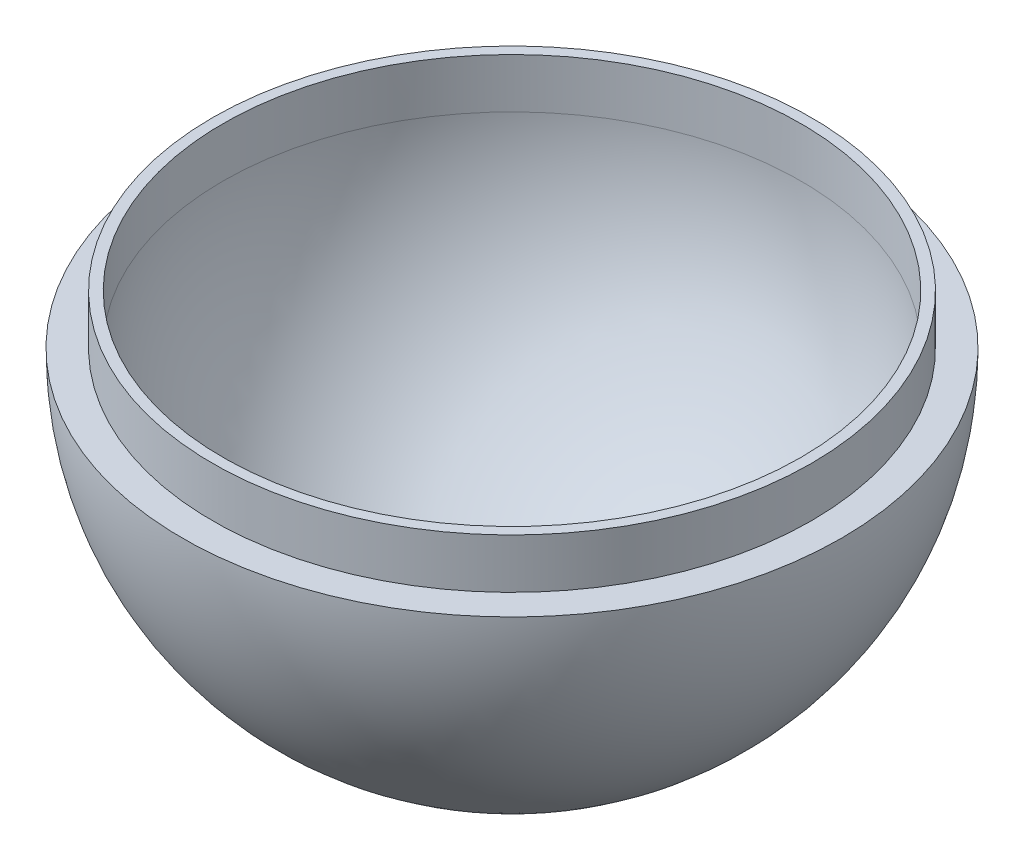
from build123d import *


with BuildPart() as part:
    # Sketch1 → Revolve2 (revolve)
    with BuildSketch(Plane.XY, mode=Mode.PRIVATE) as revolve2_sk:
        with BuildLine():
            Line((0, -25), (0, -28.503418665))
            ThreePointArc((0, -28.503418665), (-20.154960625, -20.154960625), (-28.503418665, 0))
            Line((-28.503418665, 0), (-25.9, 0))
            Line((-25.9, 0), (-25.9, 2))
            Line((-25.9, 2), (-25.9, 2.5))
            Line((-25.9, 2.5), (-25.9, 4.3))
            Line((-25.9, 4.3), (-25, 4.3))
            Line((-25, 4.3), (-25, 0))
            ThreePointArc((-25, 0), (-24.490431494, -5.021828876), (-22.982498779, -9.838940484))
            ThreePointArc((-22.982498779, -9.838940484), (-22.747404845, -10.37090029), (-22.5, -10.897247359))
            ThreePointArc((-22.5, -10.897247359), (-21.902104859, -12.053953822), (-21.244795494, -13.177961315))
            ThreePointArc((-21.244795494, -13.177961315), (-17.691022269, -17.664306696), (-13.210052688, -21.2248559))
            ThreePointArc((-13.210052688, -21.2248559), (-12.26215849, -21.786222003), (-11.29045343, -22.305283261))
            ThreePointArc((-11.29045343, -22.305283261), (-5.803788352, -24.316990783), (0, -25))
        make_face()
    revolve(revolve2_sk.sketch.rotate(Axis((0, -29.246756477, 0), (0, 1, 0)), 180), axis=Axis((0, -29.246756477, 0), (0, 1, 0)))


solid = part.part
